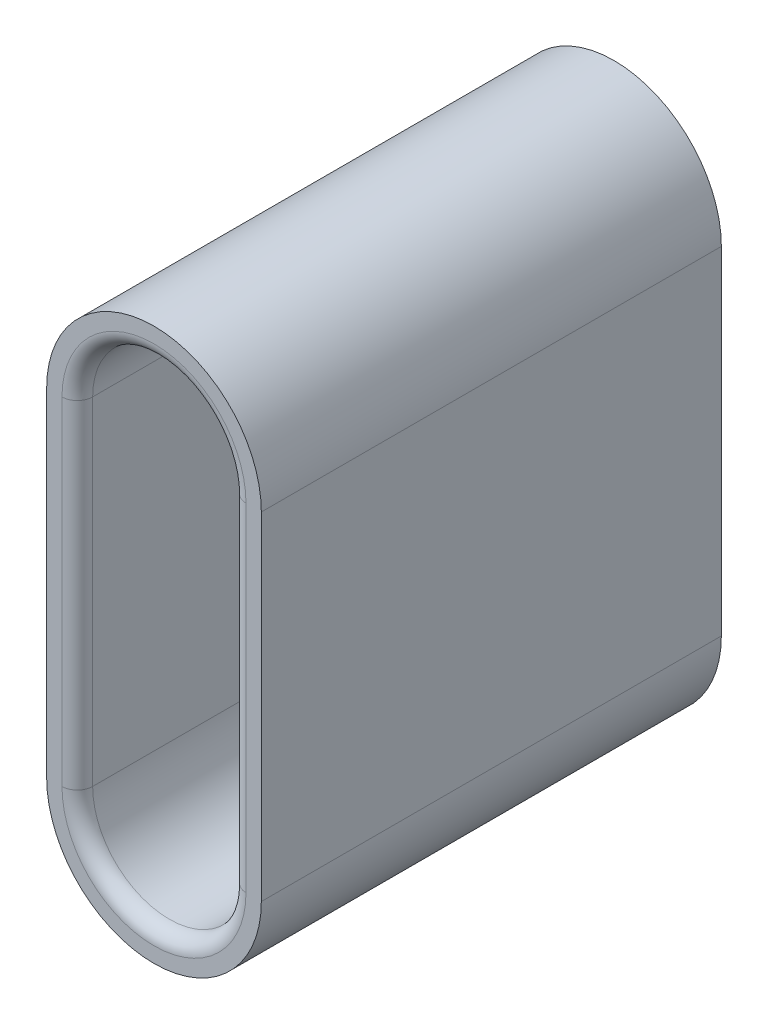
from build123d import *

# Parameters (mm, degrees)
BOSS_EXTRUDE1_DEPTH = 15
CUT_EXTRUDE1_DEPTH  = 23.005681085
FILLET1_R           = 0.5


with BuildPart() as part:
    # Sketch1 → Boss-Extrude1 (new body)
    with BuildSketch(Plane.XY):
        with BuildLine():
            Line((0, 0), (0, 11))
            ThreePointArc((0, 11), (3.5, 14.5), (7, 11))
            Line((7, 11), (7, 0))
            ThreePointArc((7, 0), (3.5, -3.5), (0, 0))
        make_face()
    extrude(amount=BOSS_EXTRUDE1_DEPTH)

    # Sketch2 → Cut-Extrude1 (cut, through all)
    with BuildSketch(Plane.XY.offset(15)):
        with BuildLine():
            Line((6, 0), (6, 11))
            ThreePointArc((6, 11), (3.5, 13.5), (1, 11))
            Line((1, 11), (1, 0))
            ThreePointArc((1, 0), (3.5, -2.5), (6, 0))
        make_face()
    extrude(amount=-CUT_EXTRUDE1_DEPTH, mode=Mode.SUBTRACT)

    # Fillet1
    fillet1_edges = [part.edges().sort_by_distance(p)[0] for p in [
        (3.5, -2.5, 0),
        (1, 5.5, 0),
        (3.5, 13.5, 0),
        (6, 5.5, 0),
        (3.5, -2.5, 15),
        (6, 5.5, 15),
        (3.5, 13.5, 15),
        (1, 5.5, 15),
    ]]
    fillet(fillet1_edges, radius=FILLET1_R)


solid = part.part
